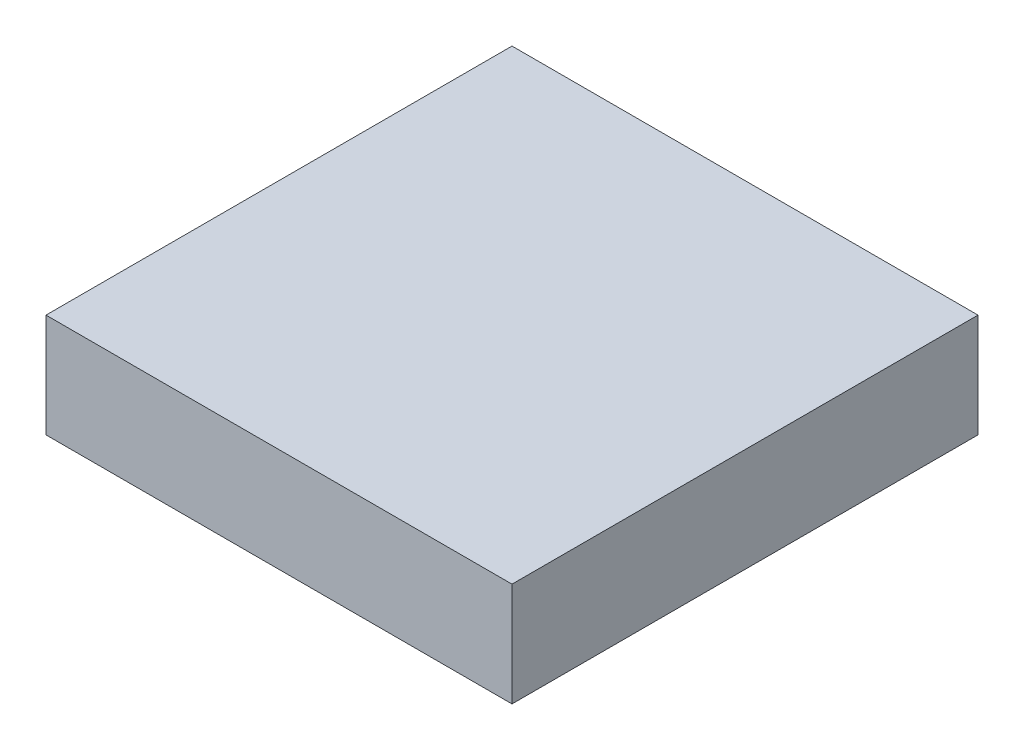
from build123d import *

# Parameters (mm, degrees)
SKETCH1_W           = 406.4
SKETCH1_H           = 406.4
BOSS_EXTRUDE1_DEPTH = 90.4875


with BuildPart() as part:
    # Sketch1 → Boss-Extrude1 (new body)
    with BuildSketch(Plane(origin=(0, 0, 0), x_dir=(1, 0, 0), z_dir=(0, 1, 0))):
        with Locations((153.989687988, 169.829998818)):
            Rectangle(SKETCH1_W, SKETCH1_H)
    extrude(amount=BOSS_EXTRUDE1_DEPTH)


solid = part.part
